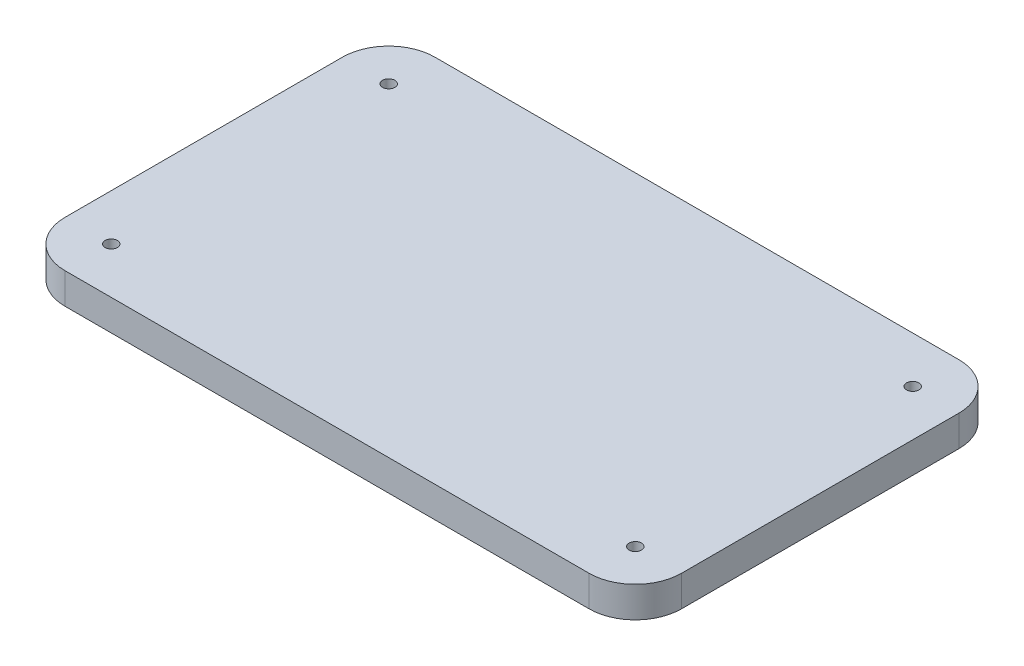
from build123d import *

# Parameters (mm, degrees)
BOSS_EXTRUDE1_DEPTH       = 6.35
F_6_40_TAPPED_HOLE2_D     = 2.54
F_6_40_TAPPED_HOLE2_DEPTH = 8.9154
F_6_40_TAPPED_HOLE2_TIP   = 0.763092986


with BuildPart() as part:
    # Sketch1 → Boss-Extrude1 (new body)
    with BuildSketch(Plane(origin=(0, 0, 0), x_dir=(1, 0, 0), z_dir=(0, 1, 0))):
        with BuildLine():
            Line((63.5, -28.575), (63.5, 28.575))
            ThreePointArc((63.5, 28.575), (60.710192091, 35.310192091), (53.975, 38.1))
            Line((53.975, 38.1), (-53.975, 38.1))
            ThreePointArc((-53.975, 38.1), (-60.710192091, 35.310192091), (-63.5, 28.575))
            Line((-63.5, 28.575), (-63.5, -28.575))
            ThreePointArc((-63.5, -28.575), (-60.710192091, -35.310192091), (-53.975, -38.1))
            Line((-53.975, -38.1), (53.975, -38.1))
            ThreePointArc((53.975, -38.1), (60.710192091, -35.310192091), (63.5, -28.575))
        make_face()
    extrude(amount=BOSS_EXTRUDE1_DEPTH)

    # #6-40 Tapped Hole2
    with Locations(Plane(origin=(53.975, 6.35, -28.575), x_dir=(0, 0, 1), z_dir=(0, 1, 0))):
        with Locations((0, 0), (57.15, 0), (0, -107.95), (57.15, -107.95)):
            Hole(F_6_40_TAPPED_HOLE2_D / 2, depth=F_6_40_TAPPED_HOLE2_DEPTH)
            with Locations((0, 0, -(F_6_40_TAPPED_HOLE2_DEPTH + F_6_40_TAPPED_HOLE2_TIP / 2))):  # 118° drill point
                Cone(0, F_6_40_TAPPED_HOLE2_D / 2, F_6_40_TAPPED_HOLE2_TIP, mode=Mode.SUBTRACT)


solid = part.part
